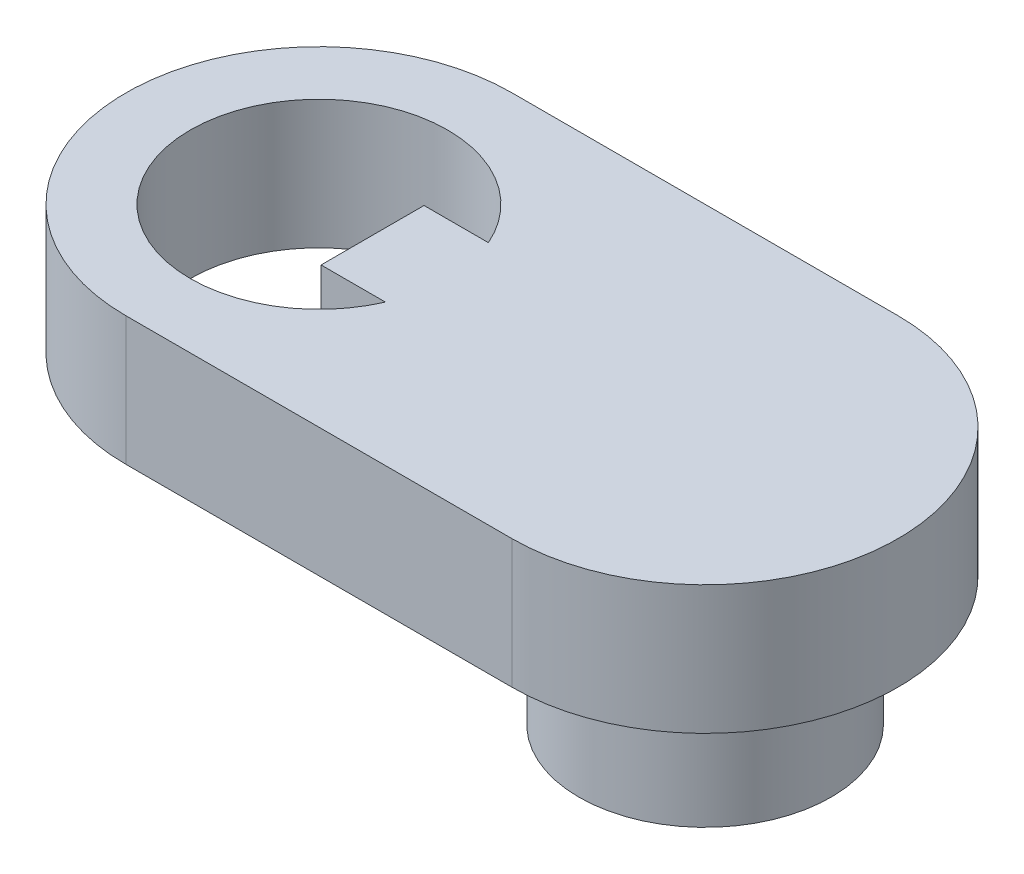
from build123d import *

# Parameters (mm, degrees)
SKETCH1_R           = 5
BOSS_EXTRUDE1_DEPTH = 5
SKETCH2_R           = 4.9
BOSS_EXTRUDE2_DEPTH = 10
BOSS_EXTRUDE3_START = -1
SKETCH4_R           = 5
BOSS_EXTRUDE3_DEPTH = 1


with BuildPart() as part:
    # Sketch1 → Boss-Extrude1 (new body)
    with BuildSketch(Plane(origin=(0, 0, 0), x_dir=(1, 0, 0), z_dir=(0, 1, 0))):
        with BuildLine():
            Line((0, 0), (15, 0))
            ThreePointArc((15, 0), (22.5, 7.5), (15, 15))
            Line((15, 15), (0, 15))
            ThreePointArc((0, 15), (-7.5, 7.5), (0, 0))
        make_face()
        with Locations(Location((15, 7.5, 0), (0, 0, 270))):
            Circle(SKETCH1_R, mode=Mode.SUBTRACT)
        with BuildLine():
            Line((4.582575695, 5.5), (2.082575695, 5.5))
            Line((2.082575695, 5.5), (2.082575695, 9.5))
            Line((2.082575695, 9.5), (4.582575695, 9.5))
            ThreePointArc((4.582575695, 9.5), (-5, 7.5), (4.582575695, 5.5))
        make_face(mode=Mode.SUBTRACT)
    extrude(amount=BOSS_EXTRUDE1_DEPTH)



with BuildPart() as body_2:
    # Sketch2 → Boss-Extrude2 (new body)
    with BuildSketch(Plane(origin=(0, 5, 0), x_dir=(1, 0, 0), z_dir=(0, 1, 0))):
        with Locations(Location((15, 7.5, 0), (0, 0, 270))):
            Circle(SKETCH2_R)
    extrude(amount=-BOSS_EXTRUDE2_DEPTH)


with BuildPart() as part_1:
    add(part.part)

    add(body_2.part)  # Boss-Extrude3 merges body 2
    # Sketch4 → Boss-Extrude3 (add)
    with BuildSketch(Plane(origin=(0, 5, 0), x_dir=(-1, 0, 0), z_dir=(0, 1, 0)).offset(BOSS_EXTRUDE3_START)):
        with Locations(Location((-15, -7.5, 0), (0, 0, 90))):
            Circle(SKETCH4_R)
    extrude(amount=BOSS_EXTRUDE3_DEPTH)


solid = part_1.part
